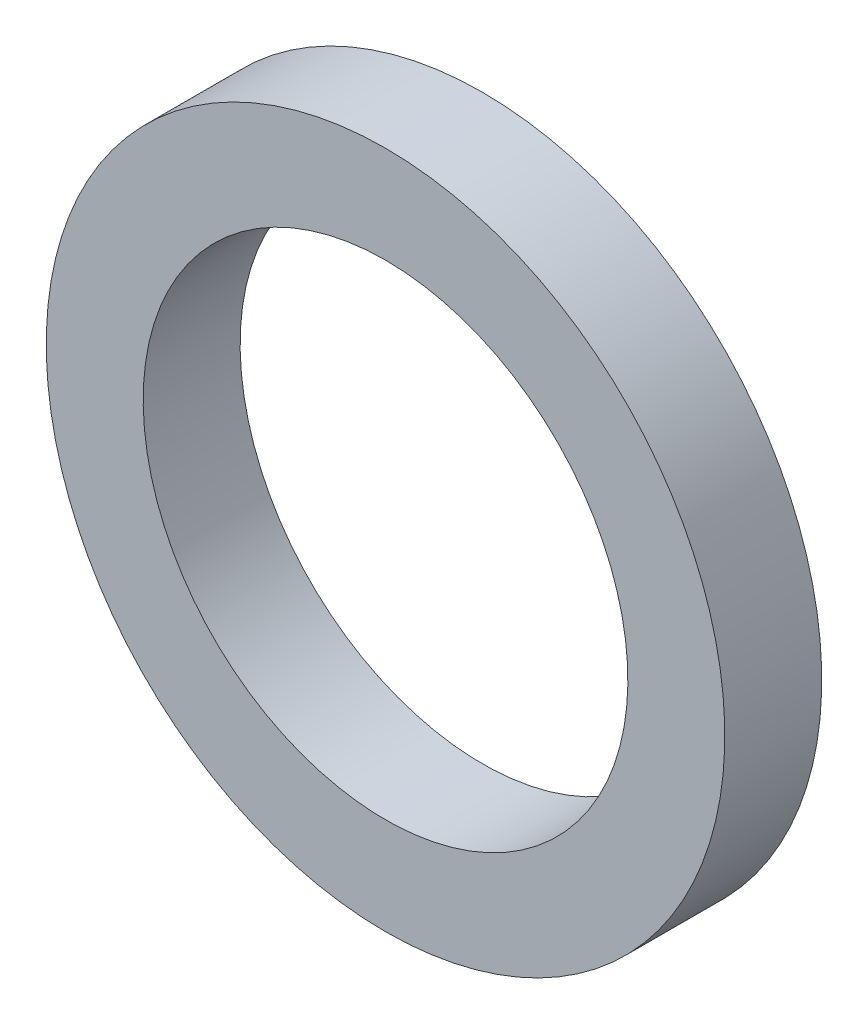
from build123d import *

# Parameters (mm, degrees)
SKETCH1_W = 5.08
SKETCH1_H = 5.08


with BuildPart() as part:
    # Sketch1 → Revolve1 (revolve)
    with BuildSketch(Plane(origin=(0, 0, 0), x_dir=(0, 0, -1), z_dir=(1, 0, 0))):
        with Locations((-2.54, 15.24)):
            Rectangle(SKETCH1_W, SKETCH1_H)
    revolve(axis=Axis((0, 0, 0), (0, 0, 1)))


solid = part.part
